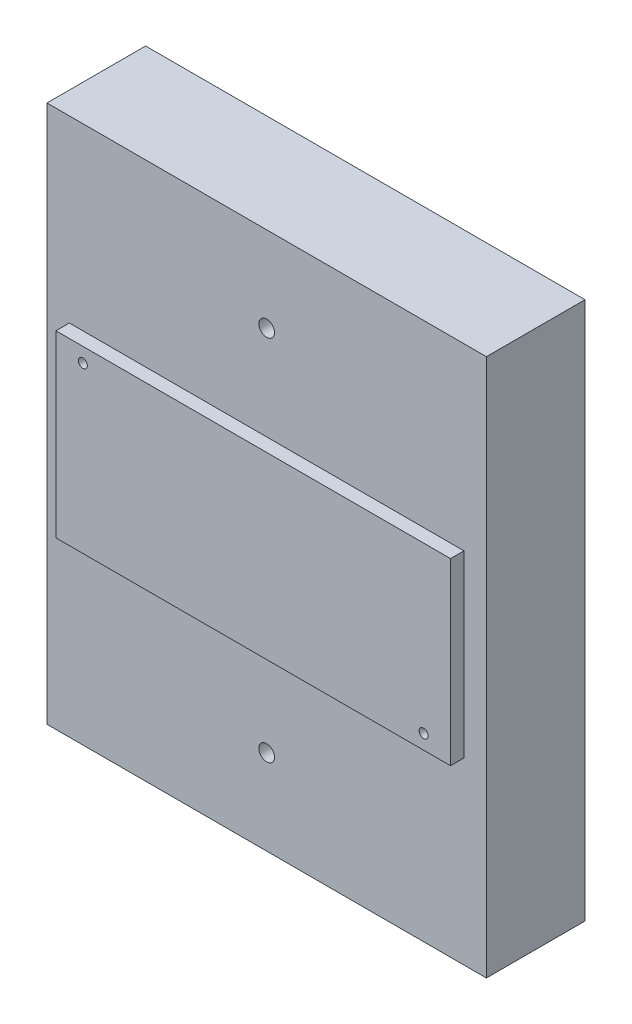
from build123d import *

# Parameters (mm, degrees)
SKETCH1_W           = 98
SKETCH1_H           = 120
SKETCH1_R           = 1.75
BOSS_EXTRUDE1_DEPTH = 22
SKETCH3_W           = 88
SKETCH3_H           = 40
SKETCH3_R           = 1
BOSS_EXTRUDE2_DEPTH = 25


with BuildPart() as part:
    # Sketch1 → Boss-Extrude1 (new body)
    with BuildSketch(Plane.XY):
        Rectangle(SKETCH1_W, SKETCH1_H)
        with Locations((0, 41)):
            Circle(SKETCH1_R, mode=Mode.SUBTRACT)
        with Locations((0, -41)):
            Circle(SKETCH1_R, mode=Mode.SUBTRACT)
    extrude(amount=BOSS_EXTRUDE1_DEPTH)

    # Sketch3 → Boss-Extrude2 (add)
    with BuildSketch(Plane.XY):
        Rectangle(SKETCH3_W, SKETCH3_H)
        with Locations((-38, 16.75)):
            Circle(SKETCH3_R, mode=Mode.SUBTRACT)
        with Locations((38, -16.75)):
            Circle(SKETCH3_R, mode=Mode.SUBTRACT)
    extrude(amount=BOSS_EXTRUDE2_DEPTH)


solid = part.part
